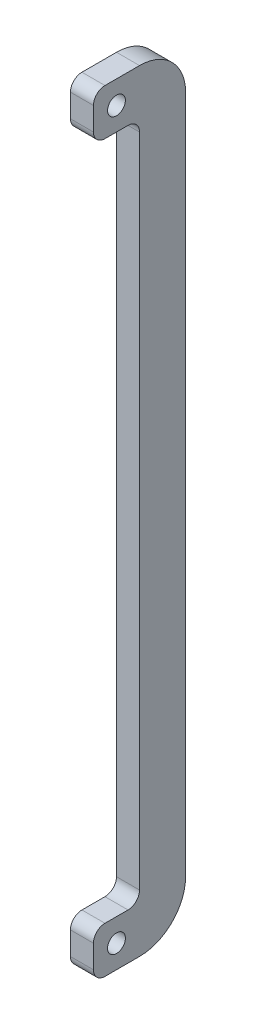
from build123d import *

# Parameters (mm, degrees)
SKETCH_1_R      = 1.55
EXTRUDE_1_DEPTH = 4
FILLET_1_R      = 2


with BuildPart() as part:
    # 草图1 → 凸台-拉伸1 (new body)
    with BuildSketch(Plane(origin=(0, 0, 0), x_dir=(0, 0, -1), z_dir=(1, 0, 0))):
        with BuildLine():
            ThreePointArc((8, 0), (5.656854249, 5.656854249), (0, 8))
            Line((0, 8), (-8, 8))
            Line((-8, 8), (-8, 0))
            Line((-8, 0), (0, 0))
            Line((0, 0), (0, -118.02))
            Line((0, -118.02), (-8, -118.02))
            Line((-8, -118.02), (-8, -126.02))
            Line((-8, -126.02), (0, -126.02))
            ThreePointArc((0, -126.02), (5.656854249, -123.676854249), (8, -118.02))
            Line((8, -118.02), (8, 0))
        make_face()
        with Locations((-4, 4)):
            Circle(SKETCH_1_R, mode=Mode.SUBTRACT)
        with Locations((-4, -122.02)):
            Circle(SKETCH_1_R, mode=Mode.SUBTRACT)
    extrude(amount=EXTRUDE_1_DEPTH)

    # 圆角1
    fillet_1_edges = [part.edges().sort_by_distance(p)[0] for p in [
        (2, -126.02, 8),
        (2, -118.02, 8),
        (2, -118.02, 0),
        (2, 0, 0),
        (2, 0, 8),
        (2, 8, 8),
    ]]
    fillet(fillet_1_edges, radius=FILLET_1_R)


solid = part.part
